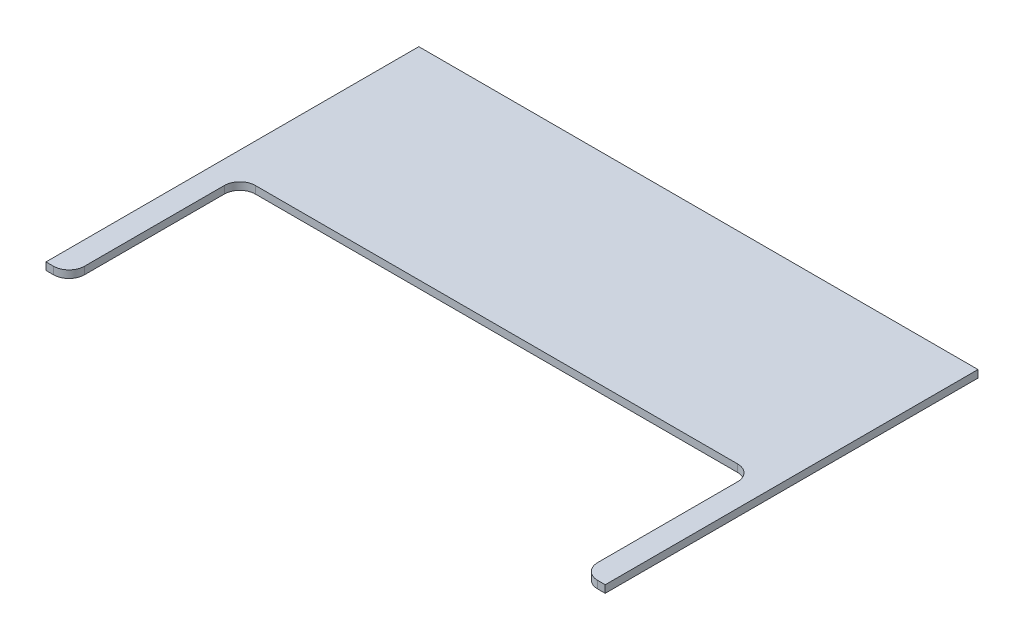
from build123d import *

# Parameters (mm, degrees)
BOSS_EXTRUDE1_DEPTH = 12


with BuildPart() as part:
    # Sketch1 → Boss-Extrude1 (new body)
    with BuildSketch(Plane(origin=(0, 0, 0), x_dir=(1, 0, 0), z_dir=(0, 1, 0))):
        with BuildLine():
            Line((-547.346938776, 337.959183673), (352.653061224, 337.959183673))
            Line((352.653061224, 337.959183673), (352.653061224, -262.040816327))
            Line((352.653061224, -262.040816327), (340.653061224, -262.040816327))
            ThreePointArc((340.653061224, -262.040816327), (322.975391695, -254.718485856), (315.653061224, -237.040816327))
            Line((315.653061224, -237.040816327), (315.653061224, -12.040816327))
            ThreePointArc((315.653061224, -12.040816327), (308.330730754, 5.636853203), (290.653061224, 12.959183673))
            Line((290.653061224, 12.959183673), (-485.346938776, 12.959183673))
            ThreePointArc((-485.346938776, 12.959183673), (-503.024608305, 5.636853203), (-510.346938776, -12.040816327))
            Line((-510.346938776, -12.040816327), (-510.346938776, -237.040816327))
            ThreePointArc((-510.346938776, -237.040816327), (-517.669269246, -254.718485856), (-535.346938776, -262.040816327))
            Line((-535.346938776, -262.040816327), (-547.346938776, -262.040816327))
            Line((-547.346938776, -262.040816327), (-547.346938776, 337.959183673))
        make_face()
    extrude(amount=BOSS_EXTRUDE1_DEPTH)


solid = part.part
